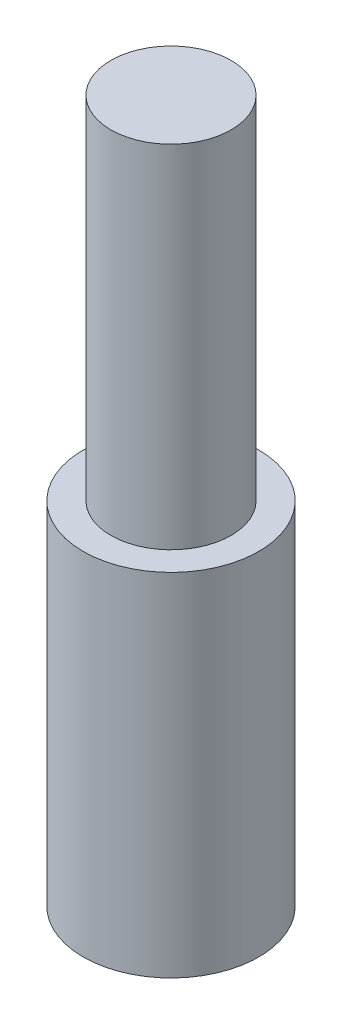
from build123d import *

# Parameters (mm, degrees)
SKETCH1_R           = 4.7625
BOSS_EXTRUDE1_DEPTH = 38.1
SKETCH2_R           = 5.567918197
SKETCH2_R_2         = 3.2625
CUT_EXTRUDE1_DEPTH  = 19.05


with BuildPart() as part:
    # Sketch1 → Boss-Extrude1 (new body)
    with BuildSketch(Plane(origin=(0, 0, 0), x_dir=(1, 0, 0), z_dir=(0, 1, 0))):
        with Locations(Location((0, 0, 0), (0, 0, 90))):
            Circle(SKETCH1_R)
    extrude(amount=BOSS_EXTRUDE1_DEPTH)

    # Sketch2 → Cut-Extrude1 (cut)
    with BuildSketch(Plane(origin=(0, 38.1, 0), x_dir=(1, 0, 0), z_dir=(0, 1, 0))):
        Circle(SKETCH2_R)
        with Locations(Location((0, 0, 0), (0, 0, 270))):
            Circle(SKETCH2_R_2, mode=Mode.SUBTRACT)
    extrude(amount=-CUT_EXTRUDE1_DEPTH, mode=Mode.SUBTRACT)


solid = part.part
